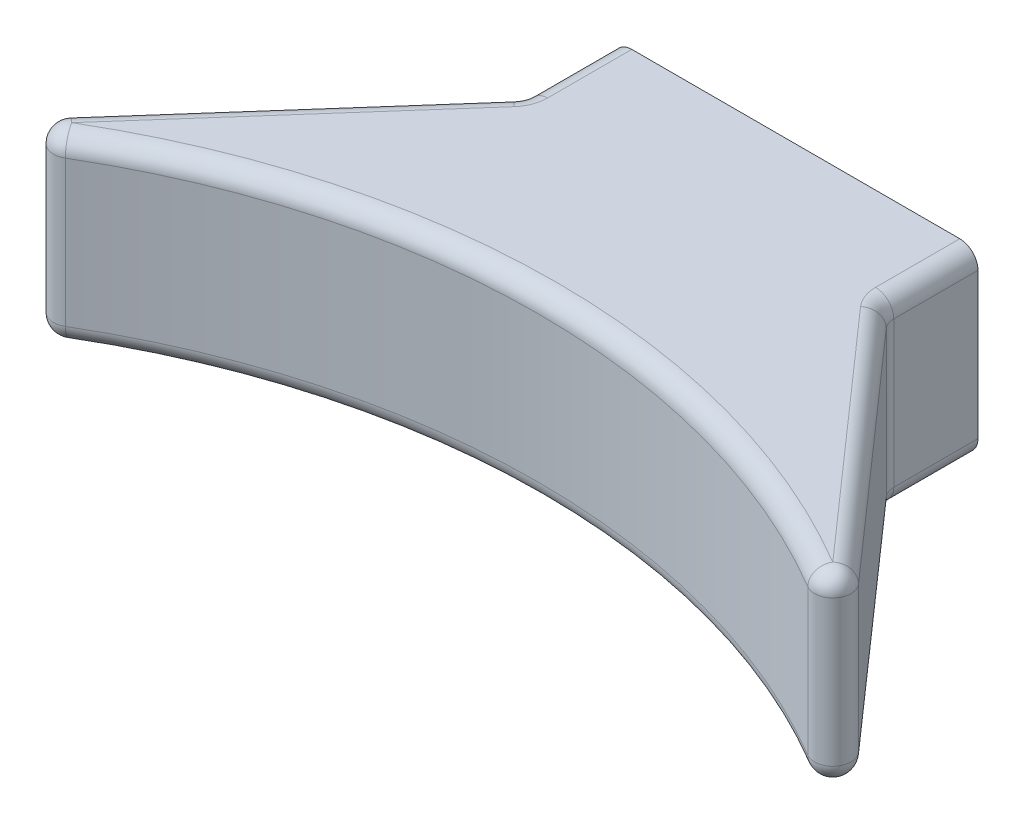
from build123d import *

# Parameters (mm, degrees)
ESQUISSE1_W             = 25.4
ESQUISSE1_H             = 12.7
BOSS_EXTRU_1_DEPTH      = 6.35
BOSS_EXTRU_2_DEPTH      = 12.7
CONG_1_R                = 1.27
ESQUISSE3_R             = 1.5
ENL_V_MAT_EXTRU_1_DEPTH = 9.525


with BuildPart() as part:
    # Esquisse1 → Boss.-Extru.1 (new body)
    with BuildSketch(Plane.XY):
        Rectangle(ESQUISSE1_W, ESQUISSE1_H)
    extrude(amount=BOSS_EXTRU_1_DEPTH)

    # Esquisse2 → Boss.-Extru.2 (add)
    with BuildSketch(Plane.XZ.offset(6.35)):
        with BuildLine():
            Line((-12.7, 6.35), (-27.474417663, 23.102614958))
            ThreePointArc((-27.474417663, 23.102614958), (-27.500391754, 24.752263413), (-25.875041622, 25.035550597))
            ThreePointArc((-25.875041622, 25.035550597), (0, 17.951934494), (25.875041622, 25.035550597))
            ThreePointArc((25.875041622, 25.035550597), (27.500391754, 24.752263413), (27.474417663, 23.102614958))
            Line((27.474417663, 23.102614958), (12.7, 6.35))
            Line((12.7, 6.35), (12.7, 0))
            Line((12.7, 0), (-12.7, 0))
            Line((-12.7, 0), (-12.7, 6.35))
        make_face()
    extrude(amount=-BOSS_EXTRU_2_DEPTH)

    # Congé1
    cong_1_edges = [part.edges().sort_by_distance(p)[0] for p in [
        (-12.7, 0, 6.35),
        (-20.087208832, 6.35, 14.726307479),
        (-27.500391754, 6.35, 24.752263413),
        (0, 6.35, 17.951934494),
        (27.500391754, 6.35, 24.752263413),
        (20.087208832, 6.35, 14.726307479),
        (20.087208832, -6.35, 14.726307479),
        (27.500391754, -6.35, 24.752263413),
        (0, -6.35, 17.951934494),
        (-27.500391754, -6.35, 24.752263413),
        (-20.087208832, -6.35, 14.726307479),
        (12.7, 0, 6.35),
        (12.7, -6.35, 3.175),
        (-12.7, -6.35, 3.175),
        (-12.7, 6.35, 3.175),
        (12.7, 6.35, 3.175),
    ]]
    fillet(cong_1_edges, radius=CONG_1_R)

    # Esquisse3 → Enlèv. mat.-Extru.1 (cut)
    with BuildSketch(Plane(origin=(0, 0, 0), x_dir=(-1, 0, 0), z_dir=(0, 0, -1))):
        with Locations((-6.35, 0)):
            Circle(ESQUISSE3_R)
        with Locations((6.35, 0)):
            Circle(ESQUISSE3_R)
    extrude(amount=-ENL_V_MAT_EXTRU_1_DEPTH, mode=Mode.SUBTRACT)


solid = part.part
